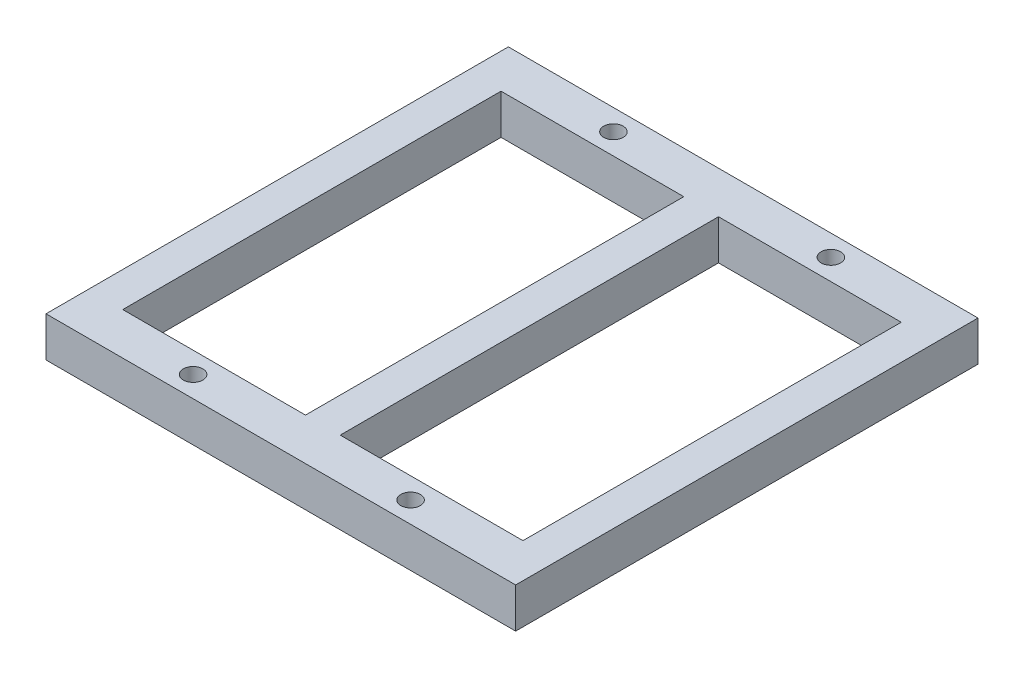
from build123d import *

# Parameters (mm, degrees)
SKETCH2_R           = 1.4732
SKETCH2_W           = 27.6098
SKETCH2_H           = 57.15
BOSS_EXTRUDE1_DEPTH = 6.0452


with BuildPart() as part:
    # Sketch2 → Boss-Extrude1 (new body)
    with BuildSketch(Plane(origin=(0, 0, 0), x_dir=(1, 0, 0), z_dir=(0, 1, 0))):
        Polygon((-19.05, 34.925), (19.05, 34.925), (19.05, -34.925), (-19.05, -34.925), (-51.9049, -34.925), (-51.9049, 34.925), align=None)
        with Locations(Location((0, 31.75, 0), (0, 0, 90))):
            Circle(SKETCH2_R, mode=Mode.SUBTRACT)
        with Locations(Location((-32.8549, 31.75, 0), (0, 0, 270))):
            Circle(SKETCH2_R, mode=Mode.SUBTRACT)
        with Locations(Location((0, -31.75, 0), (0, 0, 270))):
            Circle(SKETCH2_R, mode=Mode.SUBTRACT)
        with Locations(Location((-32.8549, -31.75, 0), (0, 0, 90))):
            Circle(SKETCH2_R, mode=Mode.SUBTRACT)
        Rectangle(SKETCH2_W, SKETCH2_H, mode=Mode.SUBTRACT)
        with Locations((-32.8549, 0)):
            Rectangle(SKETCH2_W, SKETCH2_H, mode=Mode.SUBTRACT)
    extrude(amount=BOSS_EXTRUDE1_DEPTH)


solid = part.part
